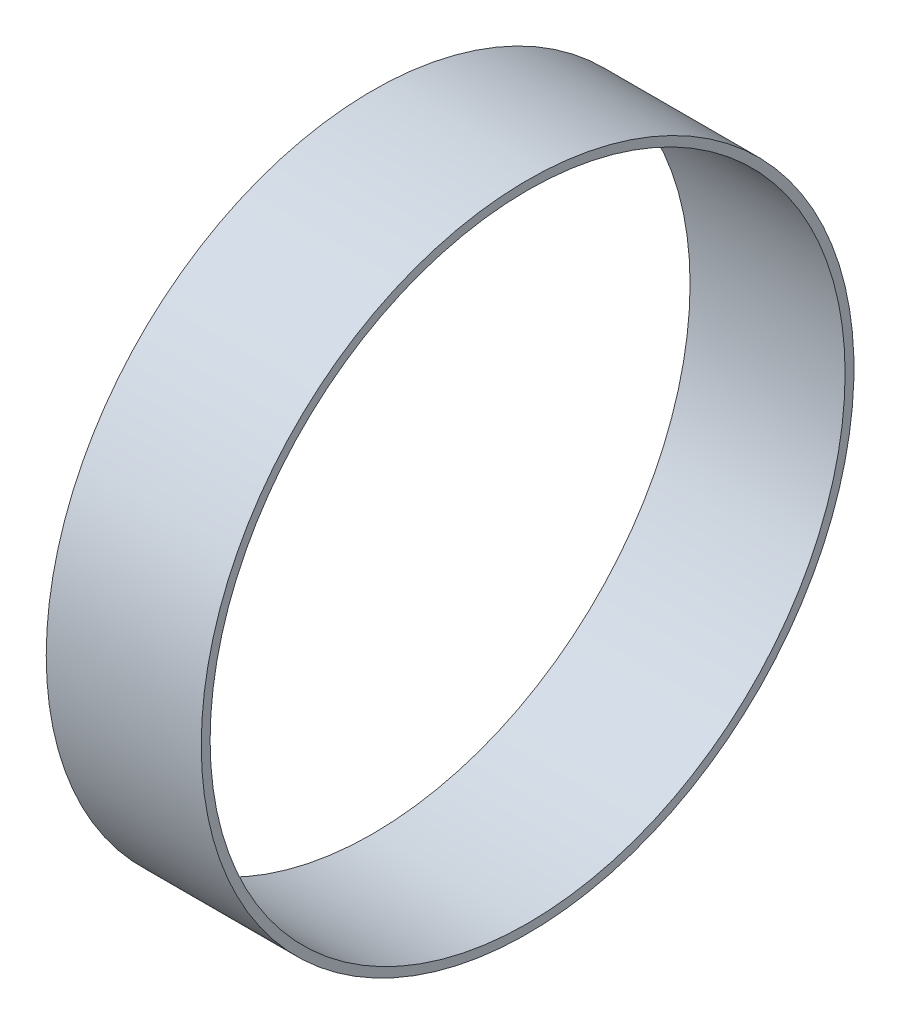
from build123d import *

# Parameters (mm, degrees)
ESQUISSE1_W = 17.5
ESQUISSE1_H = 1


with BuildPart() as part:
    # Esquisse1 → Base-Révol.-Mince (revolve)
    with BuildSketch(Plane.XY, mode=Mode.PRIVATE) as base_r_vol_mince_sk:
        with Locations((129.25, -36.34)):
            Rectangle(ESQUISSE1_W, ESQUISSE1_H)
    revolve(base_r_vol_mince_sk.sketch.rotate(Axis((0, 0, 0), (1, 0, 0)), 270), axis=Axis((0, 0, 0), (1, 0, 0)))


solid = part.part
